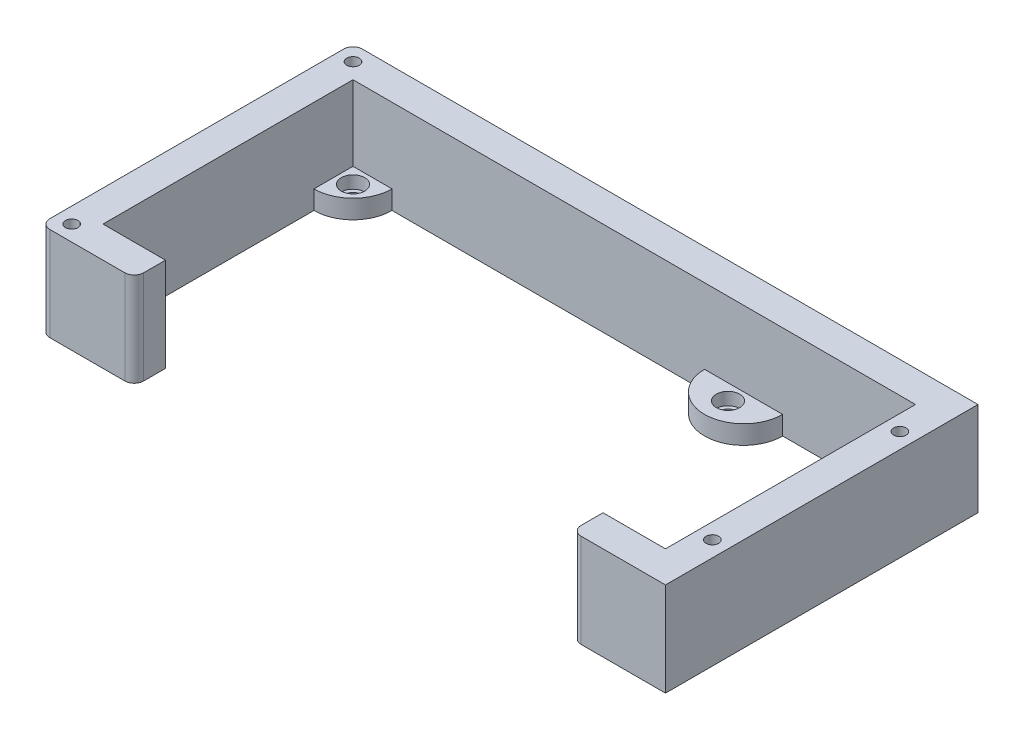
from build123d import *

# Parameters (mm, degrees)
SKETCH1_W           = 200
SKETCH1_H           = 100
SKETCH1_W_2         = 180
SKETCH1_H_2         = 80
BOSS_EXTRUDE1_DEPTH = 30
SKETCH2_R           = 2.5
BOSS_EXTRUDE2_DEPTH = 6
SKETCH3_R           = 3.75
CUT_EXTRUDE1_DEPTH  = 4
SKETCH4_R           = 2
CUT_EXTRUDE2_DEPTH  = 15
SKETCH5_W           = 140
SKETCH5_H           = 10
CUT_EXTRUDE4_DEPTH  = 116.758369028
FILLET1_R           = 3


with BuildPart() as part:
    # Sketch1 → Boss-Extrude1 (new body)
    with BuildSketch(Plane(origin=(0, 0, 0), x_dir=(1, 0, 0), z_dir=(0, 1, 0))):
        Rectangle(SKETCH1_W, SKETCH1_H)
        Rectangle(SKETCH1_W_2, SKETCH1_H_2, mode=Mode.SUBTRACT)
    extrude(amount=BOSS_EXTRUDE1_DEPTH)

    # Sketch2 → Boss-Extrude2 (add)
    # profile 1 of 3: a face of its own
    with BuildSketch(Plane(origin=(0, 0, 0), x_dir=(1, 0, 0), z_dir=(0, 1, 0))):
        with BuildLine():
            Line((-90, 40), (-77.5, 40))
            ThreePointArc((-77.5, 40), (-81.161165235, 31.161165235), (-90, 27.5))
            Line((-90, 27.5), (-90, 40))
        make_face()
        with Locations(Location((-85, 35, 0), (0, 0, 270))):
            Circle(SKETCH2_R, mode=Mode.SUBTRACT)
    # profile 2 of 3: a face of its own
    with BuildSketch(Plane(origin=(0, 0, 0), x_dir=(1, 0, 0), z_dir=(0, 1, 0))):
        with BuildLine():
            Line((-90, -40), (-90, -27.5))
            ThreePointArc((-90, -27.5), (-81.161165235, -31.161165235), (-77.5, -40))
            Line((-77.5, -40), (-90, -40))
        make_face()
        with Locations(Location((-85, -35, 0), (0, 0, 90))):
            Circle(SKETCH2_R, mode=Mode.SUBTRACT)
    # profile 3 of 3: a face of its own
    with BuildSketch(Plane(origin=(0, 0, 0), x_dir=(1, 0, 0), z_dir=(0, 1, 0))):
        with BuildLine():
            Line((22.5, 40), (47.5, 40))
            ThreePointArc((47.5, 40), (35, 27.5), (22.5, 40))
        make_face()
        with Locations(Location((35, 35, 0), (0, 0, 270))):
            Circle(SKETCH2_R, mode=Mode.SUBTRACT)
    extrude(amount=BOSS_EXTRUDE2_DEPTH)

    # Sketch3 → Cut-Extrude1 (cut)
    with BuildSketch(Plane(origin=(0, 6, 0), x_dir=(1, 0, 0), z_dir=(0, 1, 0))):
        with Locations(Location((-85, 35, 0), (0, 0, 270))):
            Circle(SKETCH3_R)
        with Locations(Location((-85, -35, 0), (0, 0, 90))):
            Circle(SKETCH3_R)
        with Locations(Location((35, 35, 0), (0, 0, 270))):
            Circle(SKETCH3_R)
    extrude(amount=-CUT_EXTRUDE1_DEPTH, mode=Mode.SUBTRACT)

    # Sketch4 → Cut-Extrude2 (cut)
    with BuildSketch(Plane(origin=(0, 30, 0), x_dir=(1, 0, 0), z_dir=(0, 1, 0))):
        with Locations(Location((-95, 45, 0), (0, 0, 270))):
            Circle(SKETCH4_R)
        with Locations(Location((-95, -45, 0), (0, 0, 90))):
            Circle(SKETCH4_R)
        with Locations(Location((95, 30, 0), (0, 0, 270))):
            Circle(SKETCH4_R)
        with Locations(Location((95, -30, 0), (0, 0, 90))):
            Circle(SKETCH4_R)
    extrude(amount=-CUT_EXTRUDE2_DEPTH, mode=Mode.SUBTRACT)

    # Sketch5 → Cut-Extrude4 (cut, through all)
    with BuildSketch(Plane(origin=(0, 30, 0), x_dir=(1, 0, 0), z_dir=(0, 1, 0))):
        with Locations((0, -45)):
            Rectangle(SKETCH5_W, SKETCH5_H)
    extrude(amount=-CUT_EXTRUDE4_DEPTH, mode=Mode.SUBTRACT)

    # Fillet1
    fillet1_edges = [part.edges().sort_by_distance(p)[0] for p in [
        (70, 15, 50),
        (-70, 15, 50),
        (-100, 15, 50),
        (-100, 15, -50),
    ]]
    fillet(fillet1_edges, radius=FILLET1_R)


solid = part.part
